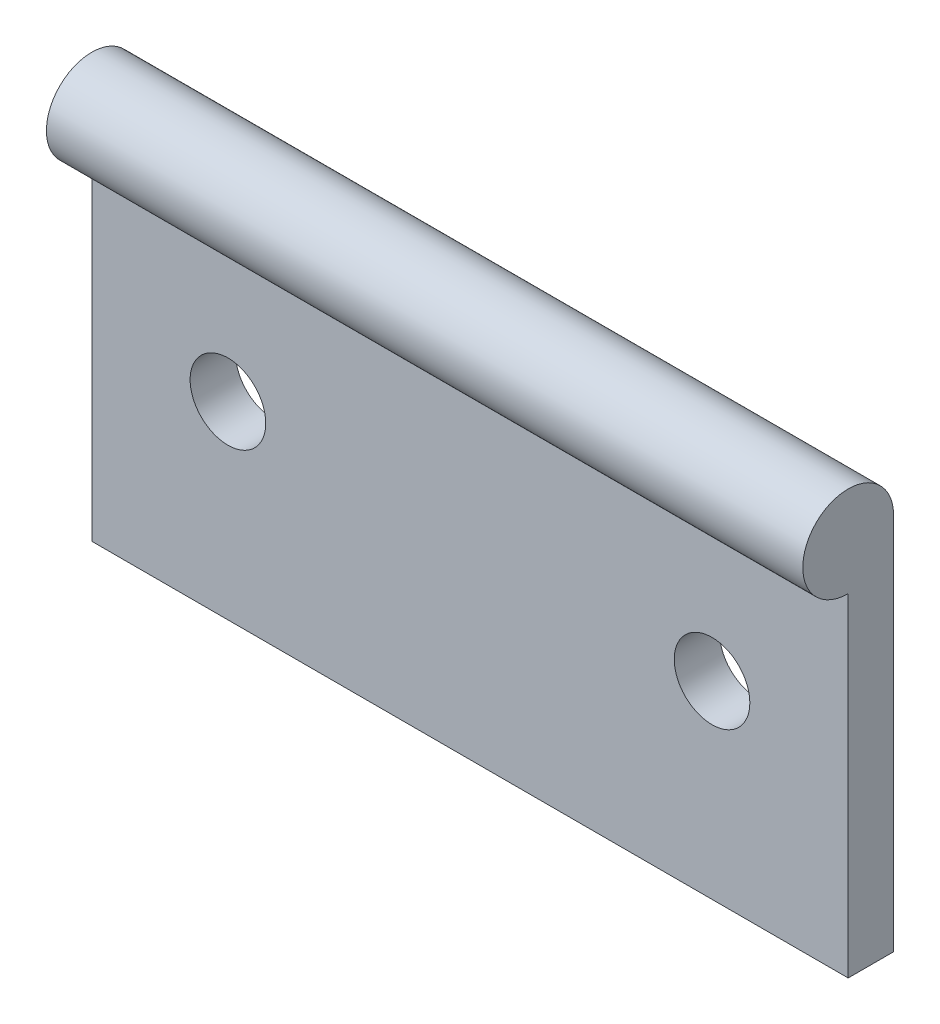
from build123d import *

# Parameters (mm, degrees)
ESQUISSE1_W             = 50
ESQUISSE1_H             = 25
BOSS_EXTRU_1_DEPTH      = 3
ESQUISSE2_R             = 3
BOSS_EXTRU_2_DEPTH      = 25
ESQUISSE3_R             = 2.5
ENL_V_MAT_EXTRU_1_DEPTH = 30.567718884


with BuildPart() as part:
    # Esquisse1 → Boss.-Extru.1 (new body)
    with BuildSketch(Plane.XY):
        Rectangle(ESQUISSE1_W, ESQUISSE1_H)
    extrude(amount=BOSS_EXTRU_1_DEPTH)

    # Esquisse2 → Boss.-Extru.2 (add, symmetric)
    with BuildSketch(Plane(origin=(0, 0, 0), x_dir=(0, 0, -1), z_dir=(1, 0, 0))):
        with Locations((-3, 12.5)):
            Circle(ESQUISSE2_R)
    extrude(amount=BOSS_EXTRU_2_DEPTH, both=True)

    # Esquisse3 → Enlèv. mat.-Extru.1 (cut, through all)
    with BuildSketch(Plane.XY.offset(3)):
        with Locations((-16, 0)):
            Circle(ESQUISSE3_R)
        with Locations((16, 0)):
            Circle(ESQUISSE3_R)
    extrude(amount=-ENL_V_MAT_EXTRU_1_DEPTH, mode=Mode.SUBTRACT)


solid = part.part
